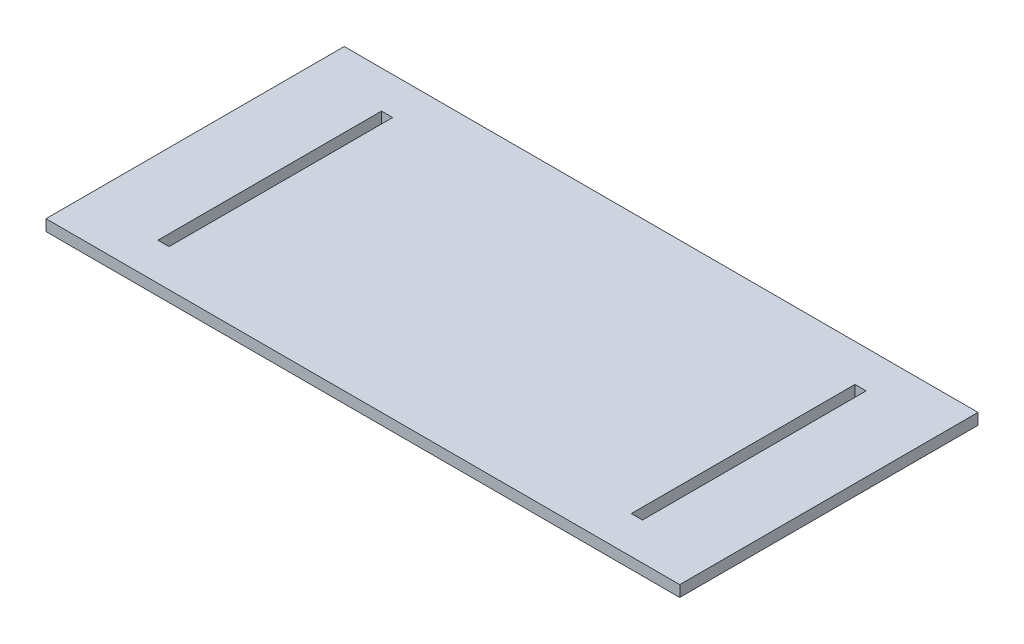
from build123d import *

# Parameters (mm, degrees)
SKETCH1_W           = 170
SKETCH1_H           = 80
BOSS_EXTRUDE1_DEPTH = 3
SKETCH2_W           = 3
SKETCH2_H           = 60
CUT_EXTRUDE1_DEPTH  = 10


with BuildPart() as part:
    # Sketch1 → Boss-Extrude1 (new body)
    with BuildSketch(Plane(origin=(0, 0, 0), x_dir=(1, 0, 0), z_dir=(0, 1, 0))):
        with Locations((85, 40)):
            Rectangle(SKETCH1_W, SKETCH1_H)
    extrude(amount=BOSS_EXTRUDE1_DEPTH)

    # Sketch2 → Cut-Extrude1 (cut)
    with BuildSketch(Plane(origin=(0, 0, 0), x_dir=(1, 0, 0), z_dir=(0, 1, 0))):
        with Locations((21.5, 40)):
            Rectangle(SKETCH2_W, SKETCH2_H)
        with Locations((148.5, 40)):
            Rectangle(SKETCH2_W, SKETCH2_H)
    extrude(amount=CUT_EXTRUDE1_DEPTH, mode=Mode.SUBTRACT)


solid = part.part
